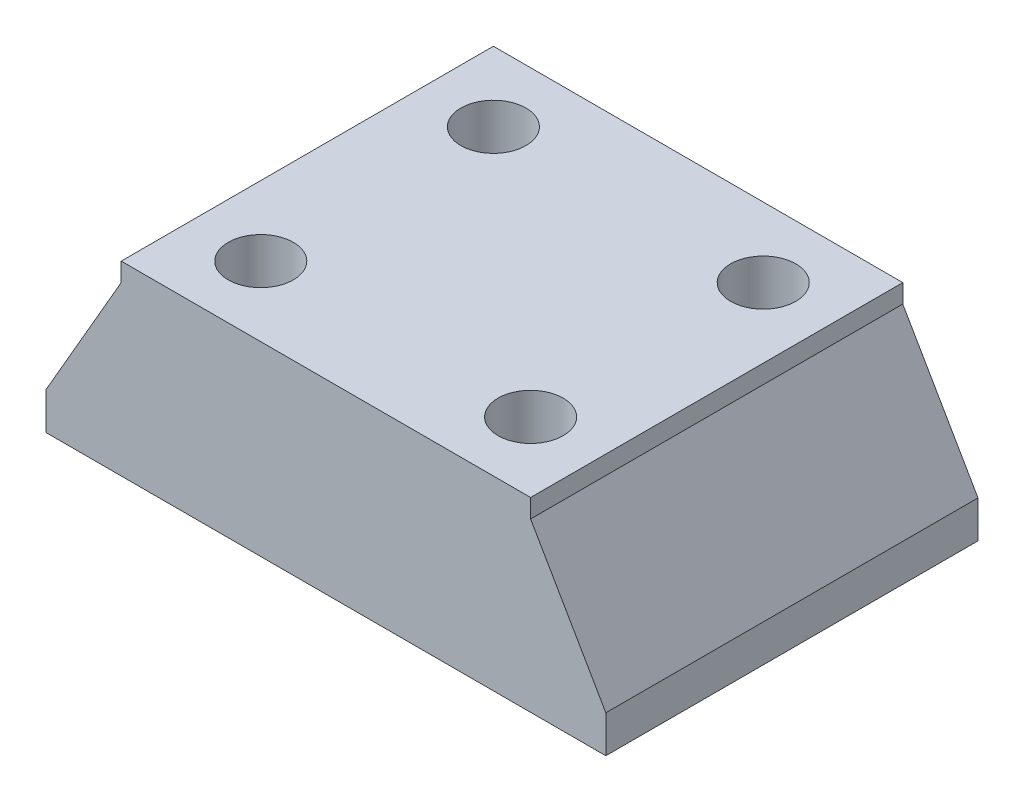
from build123d import *

# Parameters (mm, degrees)
ESTRUSIONE_ESTRUSIONE1_DEPTH = 10
SCHIZZO2_R                   = 1.75
TAGLIO_ESTRUSIONE1_DEPTH     = 21.645708387


with BuildPart() as part:
    # Schizzo1 → Estrusione-Estrusione1 (new, symmetric)
    with BuildSketch(Plane.XY):
        Polygon((11, 9), (11, 10), (-11, 10), (-11, 9), (-15.041451884, 2), (-15.041451884, 0), (15.041451884, 0), (15.041451884, 2), align=None)
    extrude(amount=ESTRUSIONE_ESTRUSIONE1_DEPTH, both=True)

    # Schizzo2 → Taglio-Estrusione1 (cut, through all)
    with BuildSketch(Plane(origin=(0, 10, 0), x_dir=(1, 0, 0), z_dir=(0, 1, 0))):
        with Locations(Location((7.25, 6.25, 0), (0, 0, 180))):
            Circle(SCHIZZO2_R)
        with Locations(Location((-7.25, 6.25, 0), (0, 0, 180))):
            Circle(SCHIZZO2_R)
        with Locations(Location((-7.25, -6.25, 0), (0, 0, 180))):
            Circle(SCHIZZO2_R)
        with Locations(Location((7.25, -6.25, 0), (0, 0, 180))):
            Circle(SCHIZZO2_R)
    extrude(amount=-TAGLIO_ESTRUSIONE1_DEPTH, mode=Mode.SUBTRACT)


solid = part.part
